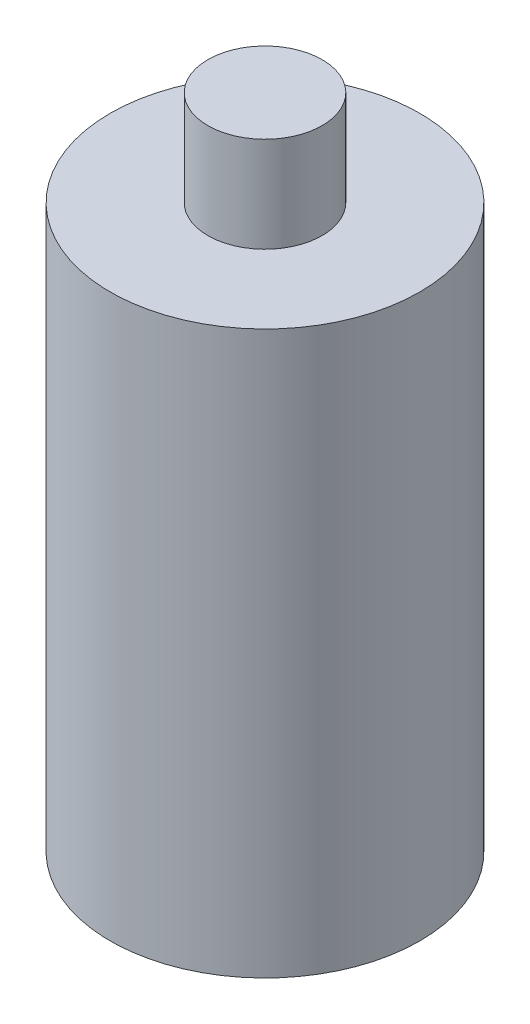
from build123d import *


with BuildPart() as part:
    # Sketch1 → Revolve1 (revolve)
    with BuildSketch(Plane.XY, mode=Mode.PRIVATE) as revolve1_sk:
        Polygon((0, 0), (3.25, 0), (3.25, 11.8), (1.2, 11.8), (1.2, 13.8), (0, 13.8), align=None)
    revolve(revolve1_sk.sketch.rotate(Axis((0, 13.8, 0), (0, -1, 0)), 180), axis=Axis((0, 13.8, 0), (0, -1, 0)))


solid = part.part
